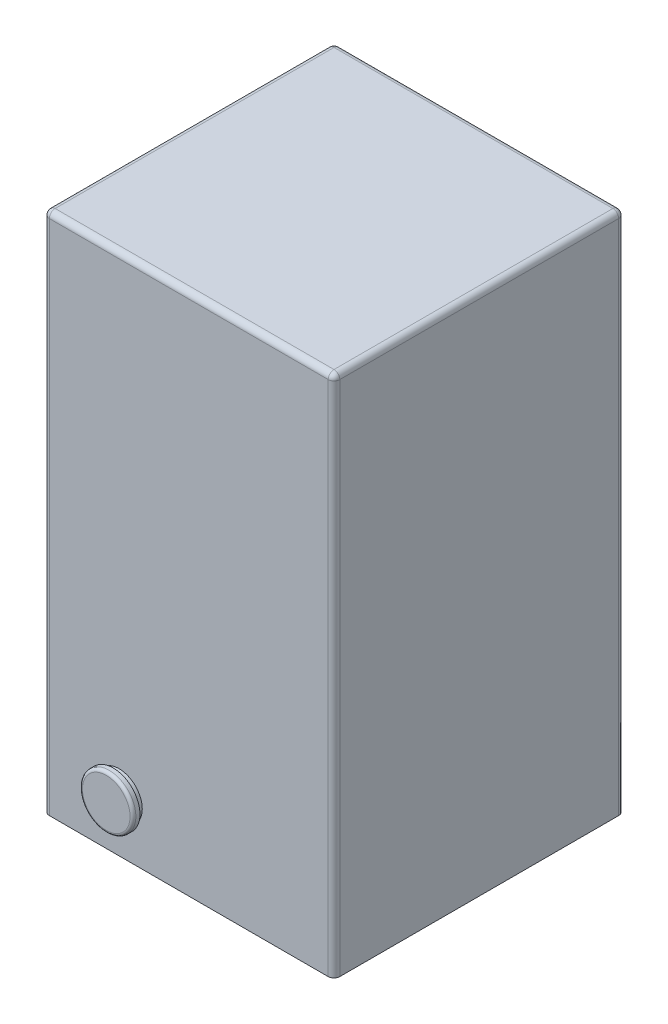
from build123d import *

# Parameters (mm, degrees)
CROQUIS1_W              = 500
CROQUIS1_H              = 900
SALIENTE_EXTRUIR1_DEPTH = 500
REDONDEO1_R             = 10
CROQUIS2_R              = 40
SALIENTE_EXTRUIR2_DEPTH = 22
CROQUIS3_R              = 46
SALIENTE_EXTRUIR3_DEPTH = 12
REDONDEO2_R             = 5


with BuildPart() as part:
    # Croquis1 → Saliente-Extruir1 (new body)
    with BuildSketch(Plane.XY):
        with Locations((250, -450)):
            Rectangle(CROQUIS1_W, CROQUIS1_H)
    extrude(amount=SALIENTE_EXTRUIR1_DEPTH)

    # Redondeo1
    redondeo1_edges = [part.edges().sort_by_distance(p)[0] for p in [
        (500, -450, 500),
        (250, 0, 500),
        (0, -450, 500),
        (250, 0, 0),
        (500, -450, 0),
        (0, -450, 0),
        (0, 0, 250),
        (500, 0, 250),
    ]]
    fillet(redondeo1_edges, radius=REDONDEO1_R)

    # Croquis2 → Saliente-Extruir2 (add)
    with BuildSketch(Plane.XY.offset(500)):
        with Locations((130, -810)):
            Circle(CROQUIS2_R)
    extrude(amount=SALIENTE_EXTRUIR2_DEPTH)

    # Croquis3 → Saliente-Extruir3 (add)
    with BuildSketch(Plane.XY.offset(522)):
        with Locations((130, -810)):
            Circle(CROQUIS3_R)
    extrude(amount=-SALIENTE_EXTRUIR3_DEPTH)

    # Redondeo2
    redondeo2_edges = [part.edges().sort_by_distance(p)[0] for p in [
        (84, -810, 522),
    ]]
    fillet(redondeo2_edges, radius=REDONDEO2_R)


solid = part.part
